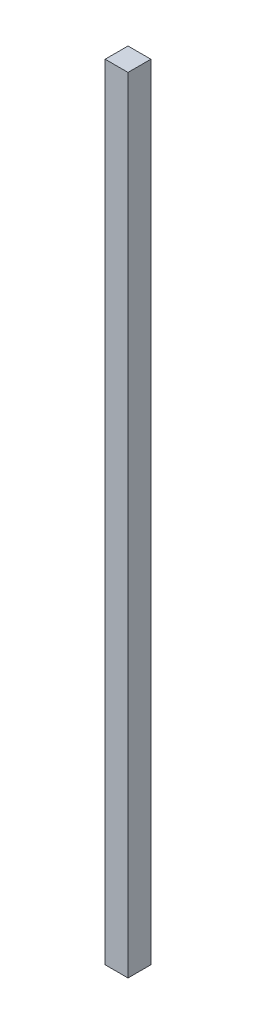
from build123d import *

# Parameters (mm, degrees)
SKETCH1_W           = 88.9
SKETCH1_H           = 3048
BOSS_EXTRUDE1_DEPTH = 88.9


with BuildPart() as part:
    # Sketch1 → Boss-Extrude1 (new body)
    with BuildSketch(Plane.XY):
        Rectangle(SKETCH1_W, SKETCH1_H)
    extrude(amount=BOSS_EXTRUDE1_DEPTH)


solid = part.part
